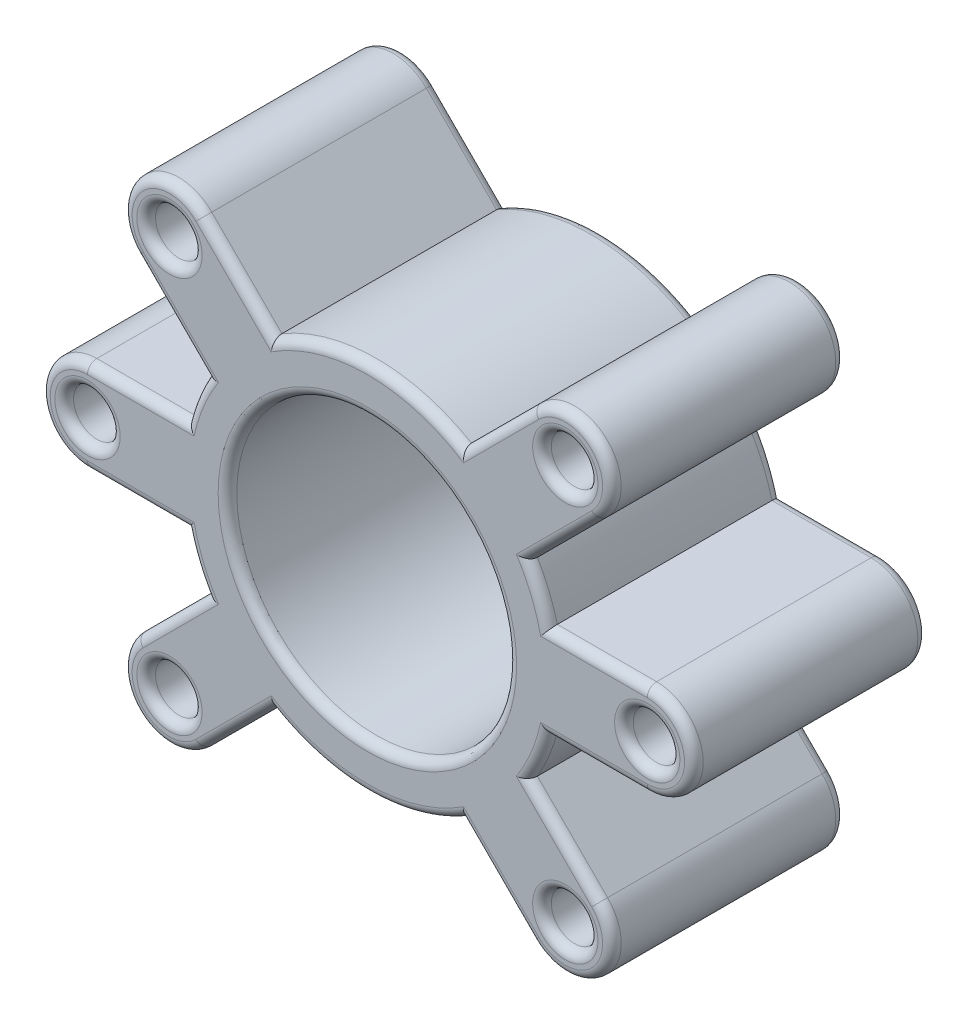
from build123d import *

# Parameters (mm, degrees)
SKETCH1_R           = 5
SKETCH1_R_2         = 40
SKETCH1_R_3         = 30
BOSS_EXTRUDE1_DEPTH = 25
FILLET1_R           = 2


with BuildPart() as part:
    # Sketch1 → Boss-Extrude1 (new, symmetric)
    # profile 1 of 7: a face of its own
    with BuildSketch(Plane.XY):
        with BuildLine():
            ThreePointArc((-34.457195687, 20.315060063), (-28.284271247, 28.284271247), (-20.315060063, 34.457195687))
            Line((-20.315060063, 34.457195687), (-35.355339059, 49.497474683))
            ThreePointArc((-35.355339059, 49.497474683), (-49.497474683, 49.497474683), (-49.497474683, 35.355339059))
            Line((-49.497474683, 35.355339059), (-34.457195687, 20.315060063))
        make_face()
        with Locations((-42.426406871, 42.426406871)):
            Circle(SKETCH1_R, mode=Mode.SUBTRACT)
    # profile 2 of 7: a face of its own
    with BuildSketch(Plane.XY):
        with BuildLine():
            ThreePointArc((-38.729833462, -10), (-40, 0), (-38.729833462, 10))
            Line((-38.729833462, 10), (-60, 10))
            ThreePointArc((-60, 10), (-70, 0), (-60, -10))
            Line((-60, -10), (-38.729833462, -10))
        make_face()
        with Locations((-60, 0)):
            Circle(SKETCH1_R, mode=Mode.SUBTRACT)
    # profile 3 of 7: a face of its own
    with BuildSketch(Plane.XY):
        with BuildLine():
            Line((-35.355339059, -49.497474683), (-20.315060063, -34.457195687))
            ThreePointArc((-20.315060063, -34.457195687), (-28.284271247, -28.284271247), (-34.457195687, -20.315060063))
            Line((-34.457195687, -20.315060063), (-49.497474683, -35.355339059))
            ThreePointArc((-49.497474683, -35.355339059), (-49.497474683, -49.497474683), (-35.355339059, -49.497474683))
        make_face()
        with Locations((-42.426406871, -42.426406871)):
            Circle(SKETCH1_R, mode=Mode.SUBTRACT)
    # profile 4 of 7: a face of its own
    with BuildSketch(Plane.XY):
        with BuildLine():
            Line((49.497474683, -35.355339059), (34.457195687, -20.315060063))
            ThreePointArc((34.457195687, -20.315060063), (28.284271247, -28.284271247), (20.315060063, -34.457195687))
            Line((20.315060063, -34.457195687), (35.355339059, -49.497474683))
            ThreePointArc((35.355339059, -49.497474683), (49.497474683, -49.497474683), (49.497474683, -35.355339059))
        make_face()
        with Locations((42.426406871, -42.426406871)):
            Circle(SKETCH1_R, mode=Mode.SUBTRACT)
    # profile 5 of 7: a face of its own
    with BuildSketch(Plane.XY):
        with BuildLine():
            Line((60, 10), (38.729833462, 10))
            ThreePointArc((38.729833462, 10), (39.681187851, 5.040171699), (40, 0))
            ThreePointArc((40, 0), (39.681187851, -5.040171699), (38.729833462, -10))
            Line((38.729833462, -10), (60, -10))
            ThreePointArc((60, -10), (70, 0), (60, 10))
        make_face()
        with Locations((60, 0)):
            Circle(SKETCH1_R, mode=Mode.SUBTRACT)
    # profile 6 of 7: a face of its own
    with BuildSketch(Plane.XY):
        with BuildLine():
            ThreePointArc((20.315060063, 34.457195687), (28.284271247, 28.284271247), (34.457195687, 20.315060063))
            Line((34.457195687, 20.315060063), (49.497474683, 35.355339059))
            ThreePointArc((49.497474683, 35.355339059), (49.497474683, 49.497474683), (35.355339059, 49.497474683))
            Line((35.355339059, 49.497474683), (20.315060063, 34.457195687))
        make_face()
        with Locations((42.426406871, 42.426406871)):
            Circle(SKETCH1_R, mode=Mode.SUBTRACT)
    # profile 7 of 7: a face of its own
    with BuildSketch(Plane.XY):
        Circle(SKETCH1_R_2)
        Circle(SKETCH1_R_3, mode=Mode.SUBTRACT)
    extrude(amount=BOSS_EXTRUDE1_DEPTH, both=True)

    # Fillet1
    fillet1_edges = [part.edges().sort_by_distance(p)[0] for p in [
        (36.9551813, 15.307337295, 25),
        (41.977335185, 27.835199561, 25),
        (49.497474683, 49.497474683, 25),
        (27.835199561, 41.977335185, 25),
        (0, 40, 25),
        (-47.426406871, 42.426406871, 25),
        (-27.835199561, 41.977335185, 25),
        (-30, 0, 25),
        (37.426406871, 42.426406871, 25),
        (55, 0, 25),
        (37.426406871, -42.426406871, 25),
        (-47.426406871, -42.426406871, 25),
        (-65, 0, 25),
        (-49.497474683, 49.497474683, 25),
        (-41.977335185, 27.835199561, 25),
        (-36.9551813, 15.307337295, 25),
        (-49.364916731, 10, 25),
        (-65, 0, -25),
        (-47.426406871, -42.426406871, -25),
        (37.426406871, -42.426406871, -25),
        (55, 0, -25),
        (37.426406871, 42.426406871, -25),
        (-30, 0, -25),
        (-27.835199561, 41.977335185, -25),
        (0, 40, -25),
        (27.835199561, 41.977335185, -25),
        (-70, 0, 25),
        (49.497474683, 49.497474683, -25),
        (41.977335185, 27.835199561, -25),
        (36.9551813, 15.307337295, -25),
        (49.364916731, 10, -25),
        (70, 0, -25),
        (49.364916731, -10, -25),
        (36.9551813, -15.307337295, -25),
        (41.977335185, -27.835199561, -25),
        (49.497474683, -49.497474683, -25),
        (27.835199561, -41.977335185, -25),
        (-49.364916731, -10, 25),
        (0, -40, -25),
        (-27.835199561, -41.977335185, -25),
        (-49.497474683, -49.497474683, -25),
        (-41.977335185, -27.835199561, -25),
        (-36.9551813, -15.307337295, -25),
        (-49.364916731, -10, -25),
        (-70, 0, -25),
        (-49.364916731, 10, -25),
        (-36.9551813, 15.307337295, -25),
        (-41.977335185, 27.835199561, -25),
        (-36.9551813, -15.307337295, 25),
        (-49.497474683, 49.497474683, -25),
        (-47.426406871, 42.426406871, -25),
        (-41.977335185, -27.835199561, 25),
        (-49.497474683, -49.497474683, 25),
        (-27.835199561, -41.977335185, 25),
        (0, -40, 25),
        (27.835199561, -41.977335185, 25),
        (49.497474683, -49.497474683, 25),
        (41.977335185, -27.835199561, 25),
        (36.9551813, -15.307337295, 25),
        (49.364916731, -10, 25),
        (70, 0, 25),
        (49.364916731, 10, 25),
    ]]
    fillet(fillet1_edges, radius=FILLET1_R)


solid = part.part
